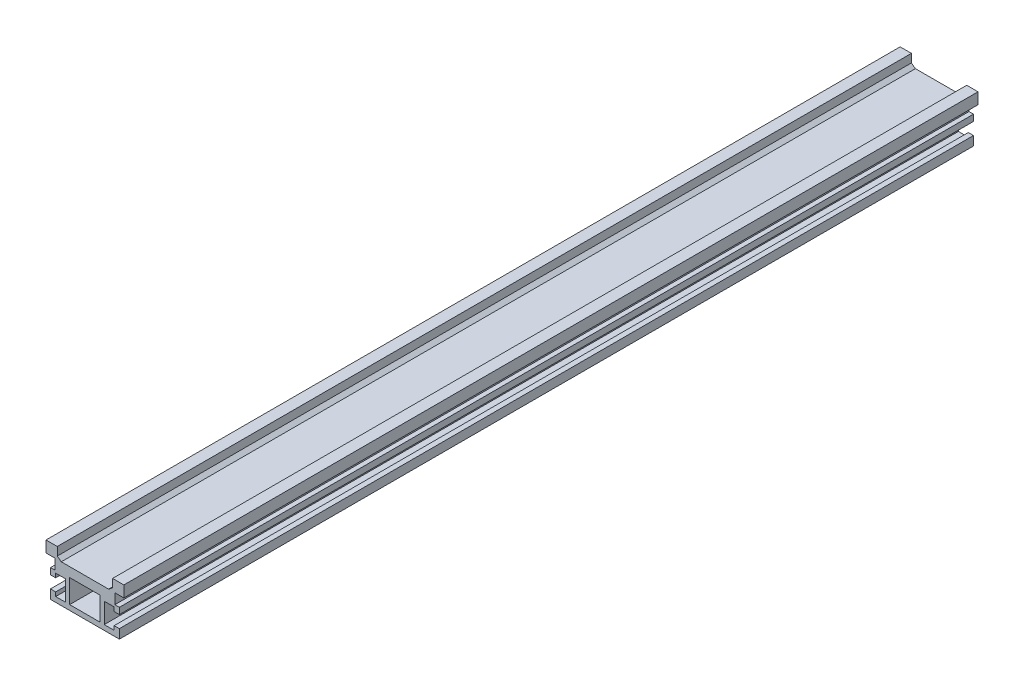
from build123d import *

# Parameters (mm, degrees)
SKETCH2_W                 = 34.55
SKETCH2_H                 = 21.85
BOSS_EXTRUDE1_DEPTH       = 379
CUT_EXTRUDE1_DEPTH        = 379
SKETCH5_W                 = 13.55
SKETCH5_H                 = 10.4
CUT_EXTRUDE2_DEPTH        = 379
F_5_0MM_DOWEL_HOLE2_D     = 5
F_5_0MM_DOWEL_HOLE2_DEPTH = 2.25


with BuildPart() as part:
    # Sketch2 → Boss-Extrude1 (new body)
    with BuildSketch(Plane.XY):
        with Locations((17.275, 10.925)):
            Rectangle(SKETCH2_W, SKETCH2_H)
    extrude(amount=-BOSS_EXTRUDE1_DEPTH)

    # Sketch3 → Cut-Extrude1 (cut)
    with BuildSketch(Plane.XY):
        Polygon((29.55, 21.85), (17.275, 21.85), (17.275, 16.85), (27.775, 16.85), (29.55, 18.1599631), align=None)
        Polygon((34.55, 0), (34.55, 16.85), (30.55, 16.85), (30.55, 12.25), (32.55, 12.25), (32.55, 9.45), (30.25, 9.45), (30.25, 11.25), (25.85, 11.25), (25.85, 2.25), (30.25, 2.25), (30.25, 4.05), (32.55, 4.05), (32.55, 0), align=None)
    cut_extrude1 = extrude(amount=-CUT_EXTRUDE1_DEPTH, mode=Mode.SUBTRACT)

    # Mirror1: Cut-Extrude1 across plane
    add(cut_extrude1.mirror(Plane(origin=(17.275, 0, 0), x_dir=(0, 0, 1), z_dir=(1, 0, 0))), mode=Mode.SUBTRACT)

    # Sketch5 → Cut-Extrude2 (cut)
    with BuildSketch(Plane.XY):
        with Locations((17.275, 7.45)):
            Rectangle(SKETCH5_W, SKETCH5_H)
    extrude(amount=-CUT_EXTRUDE2_DEPTH, mode=Mode.SUBTRACT)

    # Ø5.0mm Dowel Hole2
    with Locations(Plane(origin=(0, 0, 0), x_dir=(-1, 0, 0), z_dir=(0, -1, 0))):
        with Locations((-17.275, 359), (-17.275, 185.4), (-17.275, 158.733333333)):
            Hole(F_5_0MM_DOWEL_HOLE2_D / 2, depth=F_5_0MM_DOWEL_HOLE2_DEPTH)


solid = part.part
